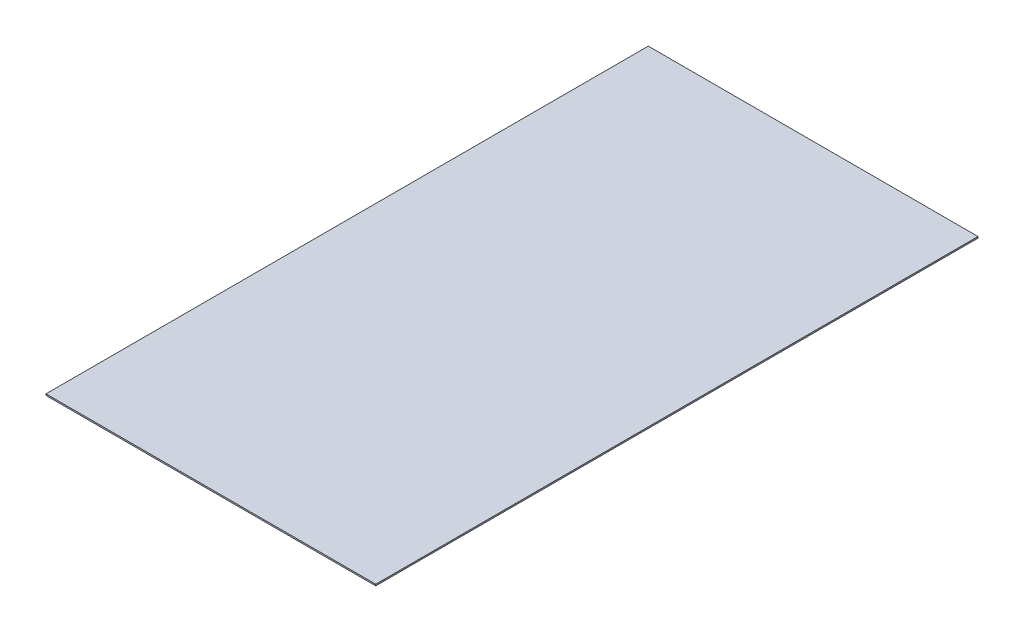
from build123d import *

# Parameters (mm, degrees)
SKETCH1_W           = 4318
SKETCH1_H           = 7886.7
BOSS_EXTRUDE1_DEPTH = 19.05


with BuildPart() as part:
    # Sketch1 → Boss-Extrude1 (new body)
    with BuildSketch(Plane(origin=(0, 0, 0), x_dir=(1, 0, 0), z_dir=(0, 1, 0))):
        with Locations((25.4, 0)):
            Rectangle(SKETCH1_W, SKETCH1_H)
    extrude(amount=BOSS_EXTRUDE1_DEPTH)


solid = part.part
